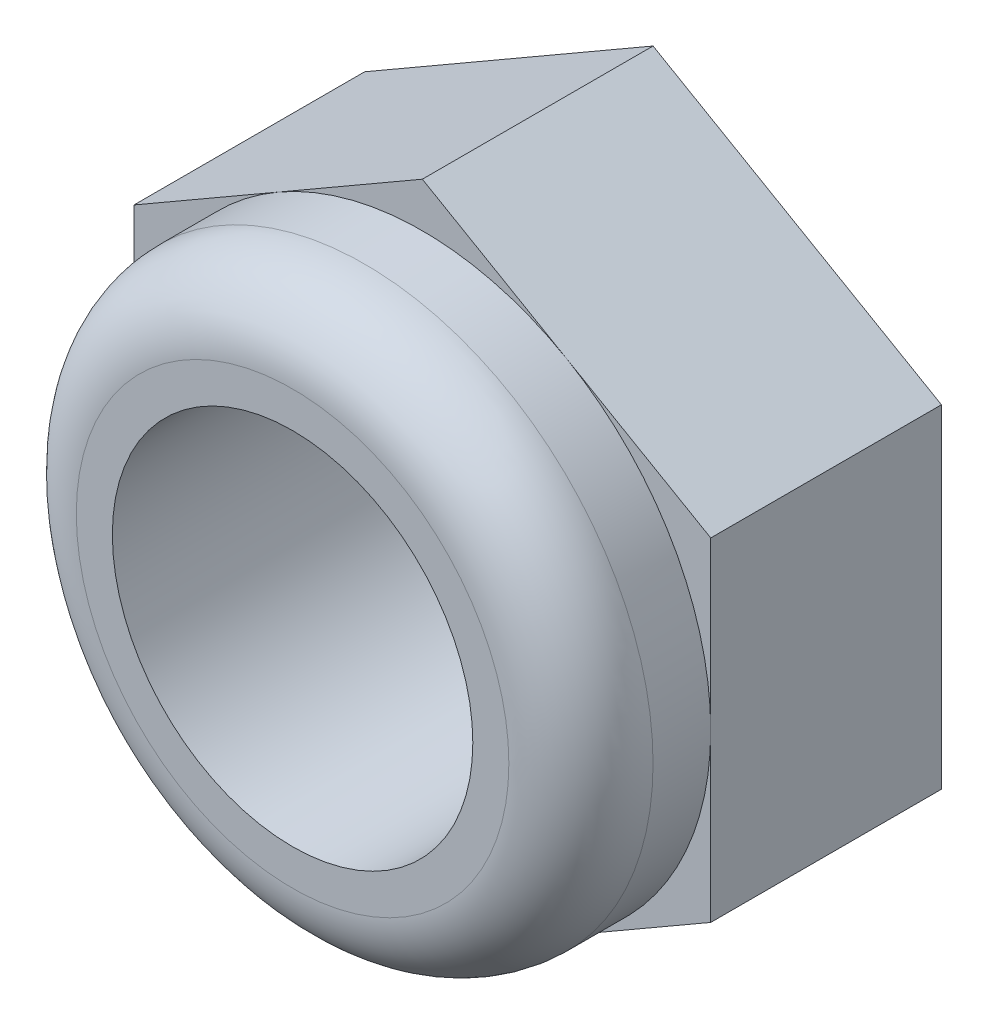
from build123d import *

# Parameters (mm, degrees)
EXTRUDE_1_DEPTH     = 3.2
SKETCH_2_R          = 4
EXTRUDE_2_DEPTH     = 1.8
SKETCH_3_R          = 2.5
CUT_EXTRUDE_1_DEPTH = 8.895146188
FILLET_1_R          = 1


with BuildPart() as part:
    # 草图1 → 凸台-拉伸1 (new body)
    with BuildSketch(Plane.XY):
        Polygon((4, -2.309401077), (4, 2.309401077), (0, 4.618802154), (-4, 2.309401077), (-4, -2.309401077), (0, -4.618802154), align=None)
    extrude(amount=EXTRUDE_1_DEPTH)

    # 草图2 → 凸台-拉伸2 (add)
    with BuildSketch(Plane.XY.offset(3.2)):
        Circle(SKETCH_2_R)
    extrude(amount=EXTRUDE_2_DEPTH)

    # 草图3 → 切除-拉伸1 (cut, through all)
    with BuildSketch(Plane.XY.offset(5)):
        Circle(SKETCH_3_R)
    extrude(amount=-CUT_EXTRUDE_1_DEPTH, mode=Mode.SUBTRACT)

    # 圆角1
    fillet_1_edges = [part.edges().sort_by_distance(p)[0] for p in [
        (-4, 0, 5),
    ]]
    fillet(fillet_1_edges, radius=FILLET_1_R)


solid = part.part
